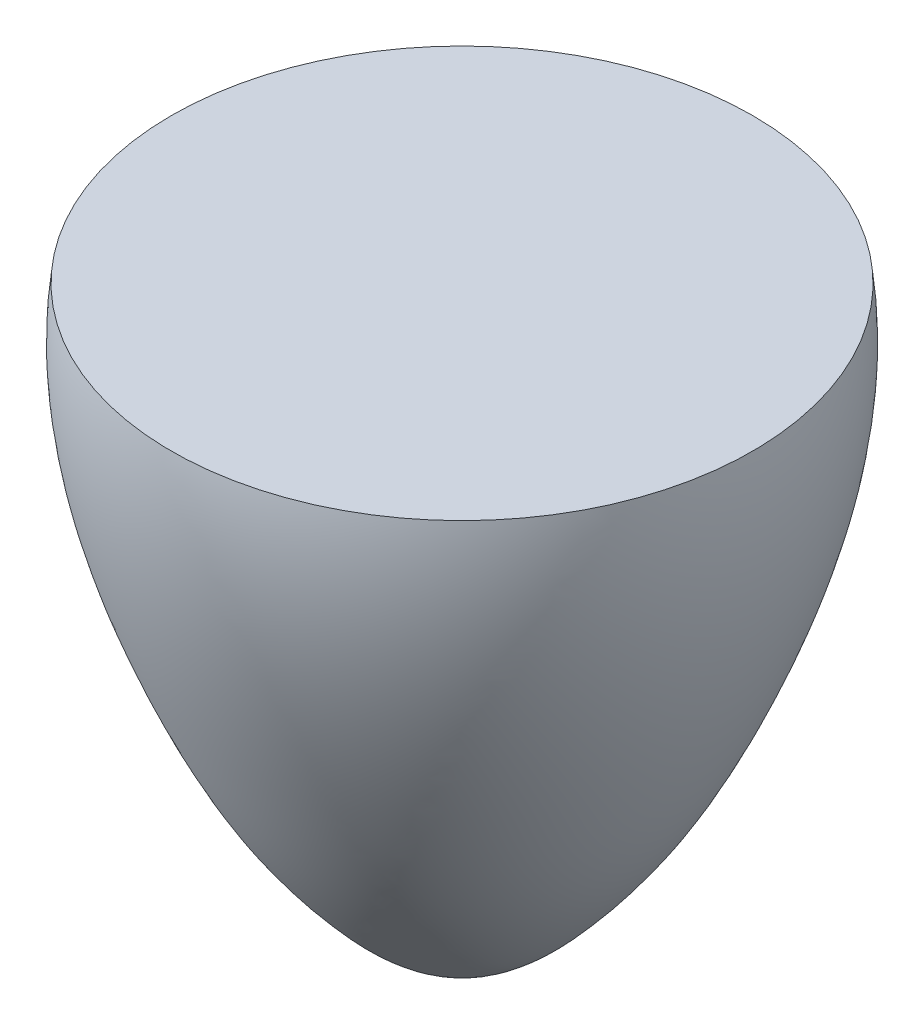
from build123d import *


with BuildPart() as part:
    # Sketch1 → Revolve1 (revolve)
    with BuildSketch(Plane.XY):
        with BuildLine():
            Line((0, 0), (0, 20.4))
            Line((0, 20.4), (-10.185106394, 20.4))
            add(Edge.make_bspline(
                [(0, 0), (-1.738183364, 0.214402458), (-3.813954996, 2.170832204), (-6.314083756, 5.57477106), (-8.078941369, 9.207620316), (-9.917022422, 14.153287067), (-10.494836411, 17.990009061), (-10.185106394, 20.4)],
                knots=[0, 0, 0, 0, 0.202199208, 0.344788644, 0.524900313, 0.701475691, 1, 1, 1, 1], degree=3))
        make_face()
    revolve(axis=Axis((0, 6.418976967, 0), (0, 1, 0)))


solid = part.part
